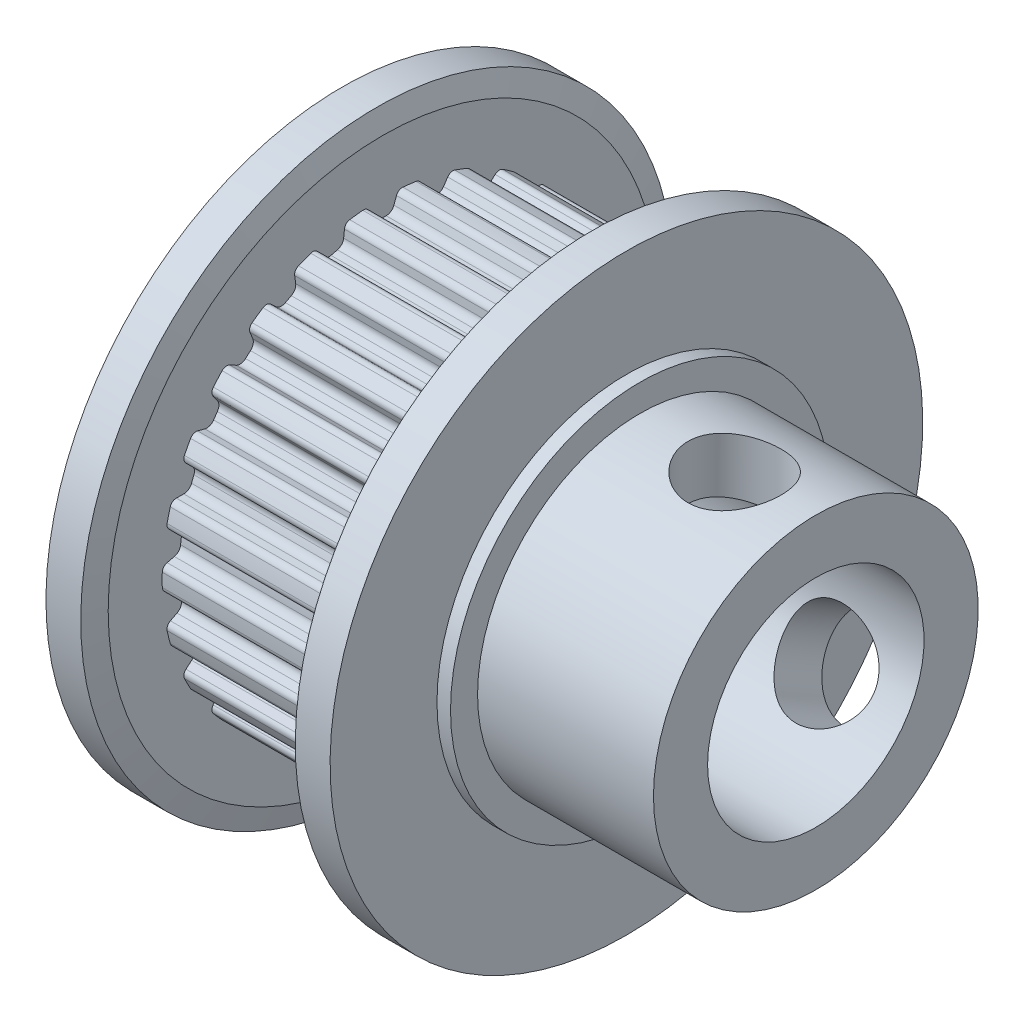
from build123d import *

# Parameters (mm, degrees)
CUT_EXTRUDE_3_DEPTH              = 3.75
FILLET_3_R                       = 0.23
FILLET_4_R                       = 0.3
PATTERN_CIRCULAR_2_COUNT         = 26
FILLET_3_OF_PATTERN_CIRCULAR_2_R = 0.23
FILLET_4_OF_PATTERN_CIRCULAR_2_R = 0.3
SKETCH_5_W                       = 6.5
SKETCH_5_H                       = 6
SKETCH_7_R                       = 4
CUT_EXTRUDE_4_DEPTH              = 24.744578329
SKETCH_31_R                      = 1.72
CUT_EXTRUDE_21_DEPTH             = 20.745062674
SKETCH_33_R                      = 1.72
CUT_EXTRUDE_22_DEPTH             = 20.745062736


with BuildPart() as part:
    # 草图1 → 旋转1 (revolve)
    with BuildSketch(Plane.XY, mode=Mode.PRIVATE) as revolve_1_sk:
        Polygon((-5.75, 7), (-3.75, 7), (-3.75, 8.155), (3.75, 8.155), (3.75, 7), (5.75, 7), (5.75, 0), (-5.75, 0), align=None)
    revolve(revolve_1_sk.sketch.rotate(Axis((-5.75, 0, 0), (1, 0, 0)), 90), axis=Axis((-5.75, 0, 0), (1, 0, 0)))

    # 草图3 → 切除-拉伸3 (cut, symmetric)
    with BuildSketch(Plane(origin=(0, 0, 0), x_dir=(0, 0, -1), z_dir=(1, 0, 0))):
        with BuildLine():
            Line((-0.335, 7.507529554), (-0.563563903, 8.135503717))
            ThreePointArc((-0.563563903, 8.135503717), (0, 8.155), (0.563563903, 8.135503717))
            Line((0.563563903, 8.135503717), (0.335, 7.507529554))
            ThreePointArc((0.335, 7.507529554), (0, 7.515), (-0.335, 7.507529554))
        make_face()
    cut_extrude_3 = extrude(amount=CUT_EXTRUDE_3_DEPTH, both=True, mode=Mode.SUBTRACT)

    # 圆角3
    fillet_3_edges = [part.edges().sort_by_distance(p)[0] for p in [
        (0, 8.135503717, 0.563563903),
        (0, 8.135503717, -0.563563903),
    ]]
    fillet(fillet_3_edges, radius=FILLET_3_R)

    # 圆角4
    fillet_4_edges = [part.edges().sort_by_distance(p)[0] for p in [
        (0, 7.507529554, -0.335),
        (0, 7.507529554, 0.335),
    ]]
    fillet(fillet_4_edges, radius=FILLET_4_R)

    # 阵列(圆周)2: 切除-拉伸3 ×26 about axis
    pattern_circular_2_axis = Axis((0, 0, 0), (1, 0, 0))
    for i in range(1, PATTERN_CIRCULAR_2_COUNT):
        add(cut_extrude_3.rotate(pattern_circular_2_axis, i * 360 / PATTERN_CIRCULAR_2_COUNT), mode=Mode.SUBTRACT)

    # 圆角3 of 阵列(圆周)2
    fillet_3_of_pattern_circular_2_edges = [part.edges().sort_by_distance(p)[0] for p in [
        (0, 7.764231095, 2.494141237),
        (0, 8.033970434, 1.399765716),
        (0, 6.941729583, 4.279768147),
        (0, 7.465531993, 3.281746039),
        (0, 5.71579998, 5.81667049),
        (0, 6.463223967, 4.973003212),
        (0, 4.157688859, 7.015529086),
        (0, 5.085296858, 6.375247514),
        (0, 2.357947973, 7.806670632),
        (0, 3.41183078, 7.406985603),
        (0, 0.421171722, 8.144116857),
        (0, 1.540081498, 8.008256613),
        (0, -1.540081498, 8.008256613),
        (0, -0.421171722, 8.144116857),
        (0, -3.41183078, 7.406985603),
        (0, -2.357947973, 7.806670632),
        (0, -5.085296858, 6.375247514),
        (0, -4.157688859, 7.015529086),
        (0, -6.463223967, 4.973003212),
        (0, -5.71579998, 5.81667049),
        (0, -7.465531993, 3.281746039),
        (0, -6.941729583, 4.279768147),
        (0, -8.033970434, 1.399765716),
        (0, -7.764231095, 2.494141237),
        (0, -8.135503717, -0.563563903),
        (0, -8.135503717, 0.563563903),
        (0, -7.764231095, -2.494141237),
        (0, -8.033970434, -1.399765716),
        (0, -6.941729583, -4.279768147),
        (0, -7.465531993, -3.281746039),
        (0, -5.71579998, -5.81667049),
        (0, -6.463223967, -4.973003212),
        (0, -4.157688859, -7.015529086),
        (0, -5.085296858, -6.375247514),
        (0, -2.357947973, -7.806670632),
        (0, -3.41183078, -7.406985603),
        (0, -0.421171722, -8.144116857),
        (0, -1.540081498, -8.008256613),
        (0, 1.540081498, -8.008256613),
        (0, 0.421171722, -8.144116857),
        (0, 3.41183078, -7.406985603),
        (0, 2.357947973, -7.806670632),
        (0, 5.085296858, -6.375247514),
        (0, 4.157688859, -7.015529086),
        (0, 6.463223967, -4.973003212),
        (0, 5.71579998, -5.81667049),
        (0, 7.465531993, -3.281746039),
        (0, 6.941729583, -4.279768147),
        (0, 8.033970434, -1.399765716),
        (0, 7.764231095, -2.494141237),
    ]]
    fillet(fillet_3_of_pattern_circular_2_edges, radius=FILLET_3_OF_PATTERN_CIRCULAR_2_R)

    # 圆角4 of 阵列(圆周)2
    fillet_4_of_pattern_circular_2_edges = [part.edges().sort_by_distance(p)[0] for p in [
        (0, 7.369545137, 1.471403913),
        (0, 7.209203642, 2.121934931),
        (0, 6.803269544, 3.19229518),
        (0, 6.491905018, 3.785550717),
        (0, 5.841612654, 4.727661854),
        (0, 5.397320473, 5.229164055),
        (0, 4.54046247, 5.988274005),
        (0, 3.989063279, 6.368877386),
        (0, 2.975437111, 6.900869438),
        (0, 2.348976228, 7.138454712),
        (0, 1.237490162, 7.412411423),
        (0, 0.572375217, 7.493170998),
        (0, -0.572375217, 7.493170998),
        (0, -1.237490162, 7.412411423),
        (0, -2.348976228, 7.138454712),
        (0, -2.975437111, 6.900869438),
        (0, -3.989063279, 6.368877386),
        (0, -4.54046247, 5.988274005),
        (0, -5.397320473, 5.229164055),
        (0, -5.841612654, 4.727661854),
        (0, -6.491905018, 3.785550717),
        (0, -6.803269544, 3.19229518),
        (0, -7.209203642, 2.121934931),
        (0, -7.369545137, 1.471403913),
        (0, -7.507529554, 0.335),
        (0, -7.507529554, -0.335),
        (0, -7.369545137, -1.471403913),
        (0, -7.209203642, -2.121934931),
        (0, -6.803269544, -3.19229518),
        (0, -6.491905018, -3.785550717),
        (0, -5.841612654, -4.727661854),
        (0, -5.397320473, -5.229164055),
        (0, -4.54046247, -5.988274005),
        (0, -3.989063279, -6.368877386),
        (0, -2.975437111, -6.900869438),
        (0, -2.348976228, -7.138454712),
        (0, -1.237490162, -7.412411423),
        (0, -0.572375217, -7.493170998),
        (0, 0.572375217, -7.493170998),
        (0, 1.237490162, -7.412411423),
        (0, 2.348976228, -7.138454712),
        (0, 2.975437111, -6.900869438),
        (0, 3.989063279, -6.368877386),
        (0, 4.54046247, -5.988274005),
        (0, 5.397320473, -5.229164055),
        (0, 5.841612654, -4.727661854),
        (0, 6.491905018, -3.785550717),
        (0, 6.803269544, -3.19229518),
        (0, 7.209203642, -2.121934931),
        (0, 7.369545137, -1.471403913),
    ]]
    fillet(fillet_4_of_pattern_circular_2_edges, radius=FILLET_4_OF_PATTERN_CIRCULAR_2_R)

    # 草图4 → 旋转2 (revolve)
    with BuildSketch(Plane.XY, mode=Mode.PRIVATE) as revolve_2_sk:
        Polygon((-5.25, 10.95), (-5.25, 7), (-3.75, 7), (-3.75, 10.15), (-3.964359354, 10.95), align=None)
        Polygon((5.25, 10.95), (5.25, 7), (3.75, 7), (3.75, 10.15), (3.964359354, 10.95), align=None)
    revolve(revolve_2_sk.sketch.rotate(Axis((-5.75, 0, 0), (1, 0, 0)), 180), axis=Axis((-5.75, 0, 0), (1, 0, 0)))

    # 草图5 → 旋转3 (revolve)
    with BuildSketch(Plane.XY, mode=Mode.PRIVATE) as revolve_3_sk:
        with Locations((9, 3)):
            Rectangle(SKETCH_5_W, SKETCH_5_H)
    revolve(revolve_3_sk.sketch.rotate(Axis((5.75, 0, 0), (1, 0, 0)), 90), axis=Axis((5.75, 0, 0), (1, 0, 0)))

    # 草图7 → 切除-拉伸4 (cut, through all)
    with BuildSketch(Plane.ZY.offset(5.75)):
        Circle(SKETCH_7_R)
    extrude(amount=-CUT_EXTRUDE_4_DEPTH, mode=Mode.SUBTRACT)

    # 草图31 → 切除-拉伸21 (cut, through all)
    with BuildSketch(Plane(origin=(0, 0, 0), x_dir=(1, 0, 0), z_dir=(0, 1, 0))):
        with Locations(Location((9.25, 0, 0), (0, 0, 90))):
            Circle(SKETCH_31_R)
    extrude(amount=CUT_EXTRUDE_21_DEPTH, mode=Mode.SUBTRACT)

    # 草图33 → 切除-拉伸22 (cut, through all)
    with BuildSketch(Plane(origin=(0, 0, 0), x_dir=(1, 0, 0), z_dir=(0, -0.49999999999999983, -0.8660254037844388))):
        with Locations(Location((9.25, 0, 0), (0, 0, 90))):
            Circle(SKETCH_33_R)
    extrude(amount=CUT_EXTRUDE_22_DEPTH, mode=Mode.SUBTRACT)


solid = part.part
